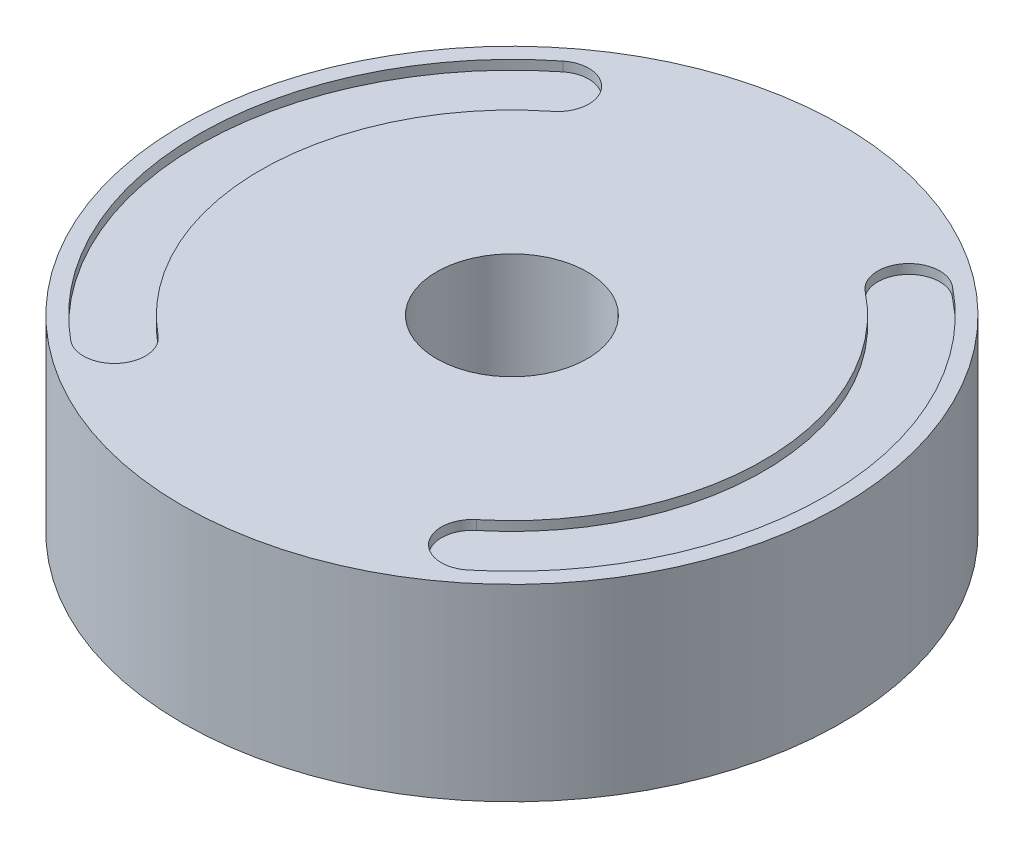
from build123d import *

# Parameters (mm, degrees)
SKETCH_3_R          = 17.5
SKETCH_3_R_2        = 4
EXTRUDE_1_DEPTH     = 10
CUT_EXTRUDE_1_DEPTH = 0.5


with BuildPart() as part:
    # 草图3 → 凸台-拉伸1 (new body)
    with BuildSketch(Plane(origin=(0, 0, 0), x_dir=(1, 0, 0), z_dir=(0, 1, 0))):
        with Locations(Location((-175, 0, 0), (0, 0, 270))):
            Circle(SKETCH_3_R)
        with Locations(Location((-175, 0, 0), (0, 0, 270))):
            Circle(SKETCH_3_R_2, mode=Mode.SUBTRACT)
    extrude(amount=EXTRUDE_1_DEPTH)

    # 草图5 → 切除-拉伸1 (cut)
    with BuildSketch(Plane(origin=(0, 10, 0), x_dir=(1, 0, 0), z_dir=(0, 1, 0))):
        with BuildLine():
            ThreePointArc((-164.451502199, -12.878997225), (-158.353020286, 0.132067312), (-164.657165804, 13.044736723))
            ThreePointArc((-164.657165804, 13.044736723), (-166.97169342, 12.777345636), (-166.704302333, 10.46281802))
            ThreePointArc((-166.704302333, 10.46281802), (-161.647923755, 0.105927492), (-166.539345315, -10.32988301))
            ThreePointArc((-166.539345315, -10.32988301), (-166.769980864, -12.648361675), (-164.451502199, -12.878997225))
        make_face()
        with BuildLine():
            ThreePointArc((-185.548497801, -12.878997225), (-191.646979714, 0.132067312), (-185.342834196, 13.044736723))
            ThreePointArc((-185.342834196, 13.044736723), (-183.02830658, 12.777345636), (-183.295697667, 10.46281802))
            ThreePointArc((-183.295697667, 10.46281802), (-188.352076245, 0.105927492), (-183.460654685, -10.32988301))
            ThreePointArc((-183.460654685, -10.32988301), (-183.230019136, -12.648361675), (-185.548497801, -12.878997225))
        make_face()
    extrude(amount=-CUT_EXTRUDE_1_DEPTH, mode=Mode.SUBTRACT)


solid = part.part
